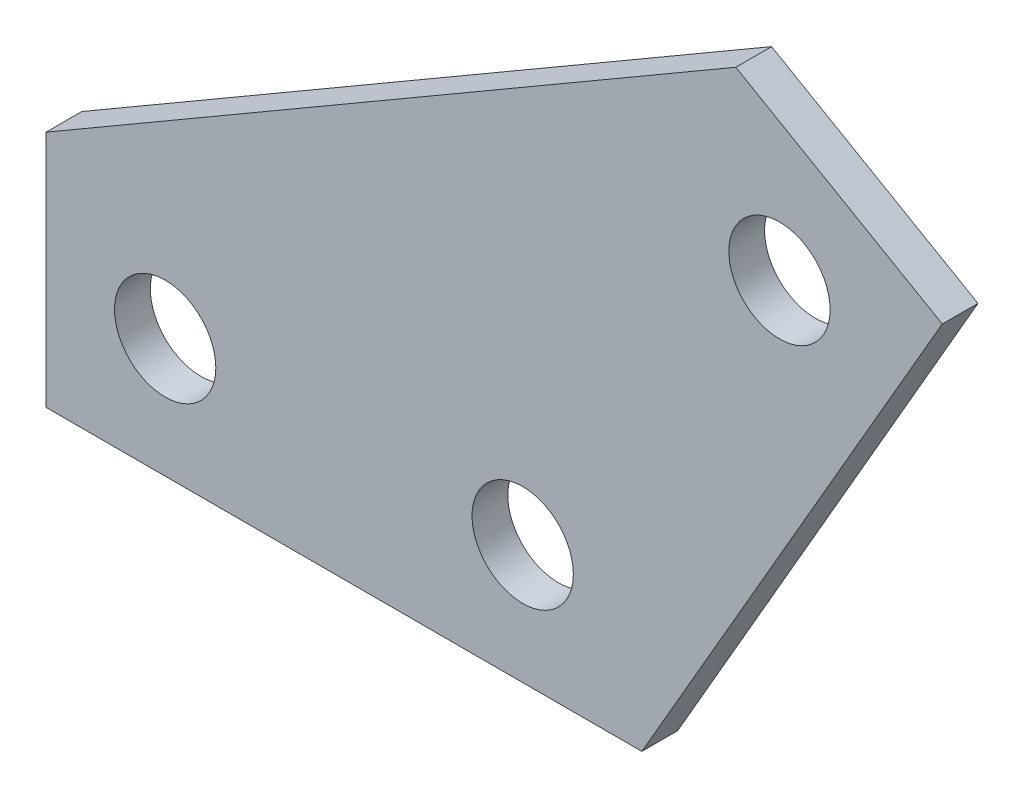
from build123d import *

# Parameters (mm, degrees)
SKETCH1_R           = 4.25
BOSS_EXTRUDE1_DEPTH = 3


with BuildPart() as part:
    # Sketch1 → Boss-Extrude1 (new body)
    with BuildSketch(Plane.XY):
        Polygon((50, 0), (75.207259422, 43.660254038), (57.886751346, 53.660254038), (0, 20), (0, 0), align=None)
        with Locations((40, 10)):
            Circle(SKETCH1_R, mode=Mode.SUBTRACT)
        with Locations((10, 10)):
            Circle(SKETCH1_R, mode=Mode.SUBTRACT)
        with Locations((61.547005384, 40)):
            Circle(SKETCH1_R, mode=Mode.SUBTRACT)
    extrude(amount=BOSS_EXTRUDE1_DEPTH)


solid = part.part
